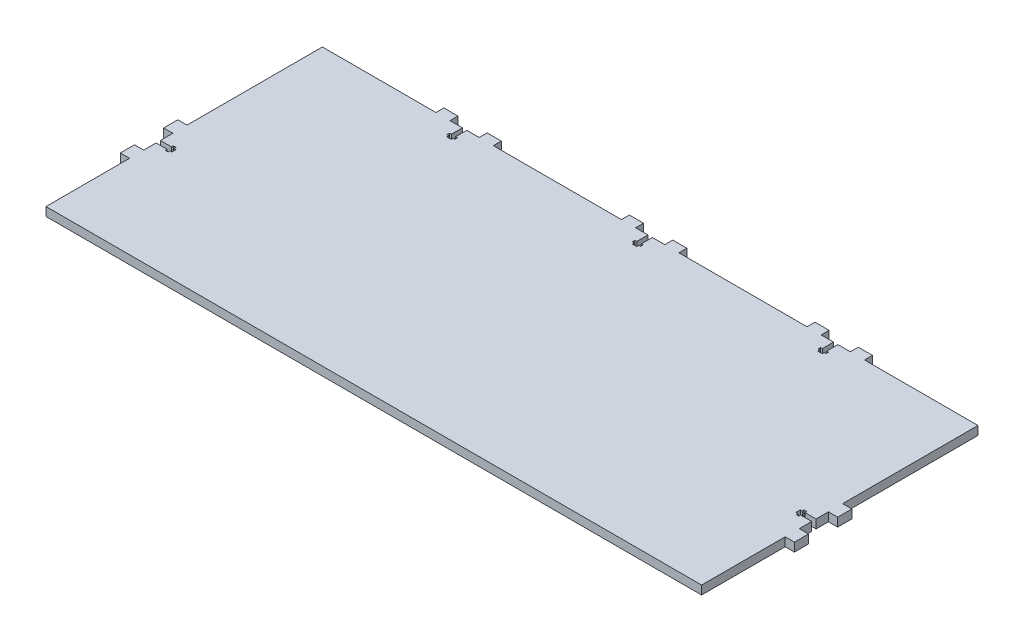
from build123d import *

# Parameters (mm, degrees)
BOSS_EXTRUDE1_DEPTH = 6


with BuildPart() as part:
    # Sketch1 → Boss-Extrude1 (new body)
    with BuildSketch(Plane(origin=(0, 0, 0), x_dir=(1, 0, 0), z_dir=(0, 1, 0))):
        Polygon((230.969596825, 56.078845433), (230.969596825, 149.820922954), (152.368237652, 149.820922954), (152.368237652, 155.320922954), (142.568237652, 155.320922954), (142.568237652, 149.820922954), (133.969596825, 149.820922954), (133.969596825, 142.120922954), (135.218237652, 142.120922954), (135.218237652, 140.320922954), (133.969596825, 140.320922954), (133.969596825, 138.920922954), (130.968237652, 138.920922954), (130.968237652, 140.320922954), (129.718237652, 140.320922954), (129.718237652, 142.120922954), (130.968237652, 142.120922954), (130.968237652, 149.820922954), (122.368237652, 149.820922954), (122.368237652, 155.320922954), (112.568237652, 155.320922954), (112.568237652, 149.820922954), (23.868917239, 149.820922954), (23.868917239, 155.320922954), (14.068917239, 155.320922954), (14.068917239, 149.820922954), (5.470276412, 149.820922954), (5.470276412, 142.120922954), (6.718917239, 142.120922954), (6.718917239, 140.320922954), (5.470276412, 140.320922954), (5.470276412, 138.920922954), (2.468917239, 138.920922954), (2.468917239, 140.320922954), (1.218917239, 140.320922954), (1.218917239, 142.120922954), (2.468917239, 142.120922954), (2.468917239, 149.820922954), (-6.131082761, 149.820922954), (-6.131082761, 155.320922954), (-15.931082761, 155.320922954), (-15.931082761, 149.820922954), (-104.630403175, 149.820922954), (-104.630403175, 155.320922954), (-114.430403175, 155.320922954), (-114.430403175, 149.820922954), (-123.029044001, 149.820922954), (-123.029044001, 142.120922954), (-121.780403175, 142.120922954), (-121.780403175, 140.320922954), (-123.029044001, 140.320922954), (-123.029044001, 138.920922954), (-126.030403175, 138.920922954), (-126.030403175, 140.320922954), (-127.280403175, 140.320922954), (-127.280403175, 142.120922954), (-126.030403175, 142.120922954), (-126.030403175, 149.820922954), (-134.630403175, 149.820922954), (-134.630403175, 155.320922954), (-144.430403175, 155.320922954), (-144.430403175, 149.820922954), (-223.030403175, 149.820922954), (-223.030403175, 56.078845433), (-229.430403175, 56.078845433), (-229.430403175, 46.278845433), (-223.030403175, 46.278845433), (-223.030403175, 37.67952502), (-215.330403175, 37.67952502), (-215.330403175, 38.92952502), (-213.530403175, 38.92952502), (-213.530403175, 37.67952502), (-212.130403175, 37.67952502), (-212.130403175, 34.678165847), (-213.530403175, 34.678165847), (-213.530403175, 33.42952502), (-215.330403175, 33.42952502), (-215.330403175, 34.678165847), (-223.030403175, 34.678165847), (-223.030403175, 26.078845433), (-229.430403175, 26.078845433), (-229.430403175, 16.278845433), (-223.030403175, 16.278845433), (-223.030403175, -41.581154567), (230.969596825, -41.581154567), (230.969596825, 16.278845433), (237.369596825, 16.278845433), (237.369596825, 26.078845433), (230.969596825, 26.078845433), (230.969596825, 34.678165847), (223.269596825, 34.678165847), (223.269596825, 33.42952502), (221.469596825, 33.42952502), (221.469596825, 34.678165847), (220.069596825, 34.678165847), (220.069596825, 37.67952502), (221.469596825, 37.67952502), (221.469596825, 38.92952502), (223.269596825, 38.92952502), (223.269596825, 37.67952502), (230.969596825, 37.67952502), (230.969596825, 46.278845433), (237.369596825, 46.278845433), (237.369596825, 56.078845433), align=None)
    extrude(amount=BOSS_EXTRUDE1_DEPTH)


solid = part.part
